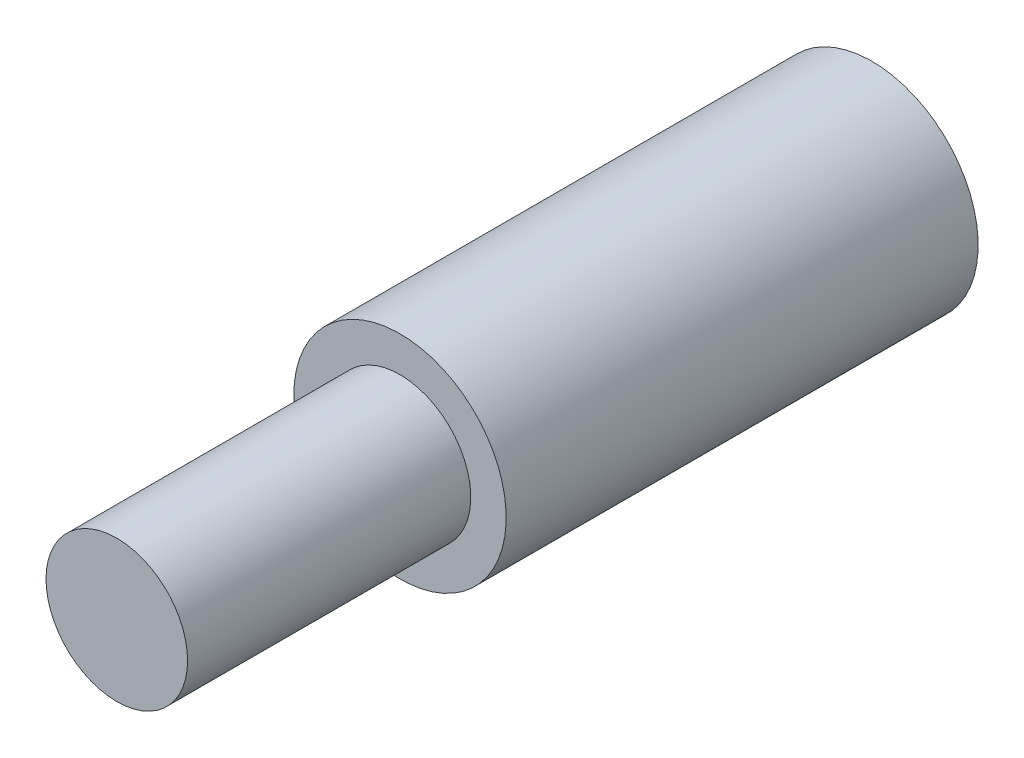
from build123d import *

# Parameters (mm, degrees)
SKETCH1_R           = 1.5
BOSS_EXTRUDE1_DEPTH = 6
SKETCH2_R           = 2.25
BOSS_EXTRUDE2_DEPTH = 10
SKETCH3_R           = 1.5
CUT_EXTRUDE1_DEPTH  = 4.5


with BuildPart() as part:
    # Sketch1 → Boss-Extrude1 (new body)
    with BuildSketch(Plane.XY):
        Circle(SKETCH1_R)
    extrude(amount=BOSS_EXTRUDE1_DEPTH)

    # Sketch2 → Boss-Extrude2 (add)
    with BuildSketch(Plane(origin=(0, 0, 0), x_dir=(-1, 0, 0), z_dir=(0, 0, -1))):
        Circle(SKETCH2_R)
    extrude(amount=BOSS_EXTRUDE2_DEPTH)

    # Sketch3 → Cut-Extrude1 (cut)
    with BuildSketch(Plane(origin=(0, 0, -10), x_dir=(-1, 0, 0), z_dir=(0, 0, -1))):
        Circle(SKETCH3_R)
    extrude(amount=-CUT_EXTRUDE1_DEPTH, mode=Mode.SUBTRACT)


solid = part.part
